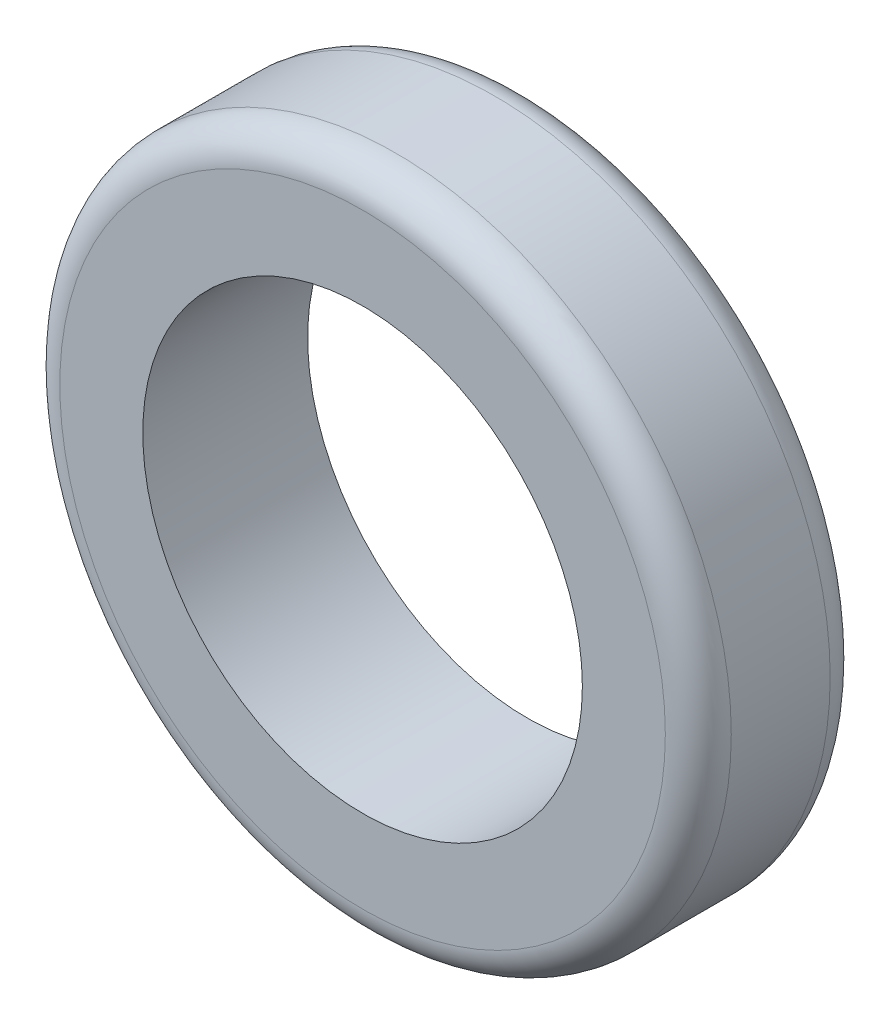
from build123d import *

# Parameters (mm, degrees)
ESQUISSE1_R        = 30.55
ESQUISSE1_R_2      = 20
BOSS_EXTRU_1_DEPTH = 15
CONG_1_R           = 3


with BuildPart() as part:
    # Esquisse1 → Boss.-Extru.1 (new body)
    with BuildSketch(Plane.XY):
        Circle(ESQUISSE1_R)
        Circle(ESQUISSE1_R_2, mode=Mode.SUBTRACT)
    extrude(amount=BOSS_EXTRU_1_DEPTH)

    # Congé1
    cong_1_edges = [part.edges().sort_by_distance(p)[0] for p in [
        (-30.55, 0, 0),
        (-30.55, 0, 15),
    ]]
    fillet(cong_1_edges, radius=CONG_1_R)


solid = part.part
